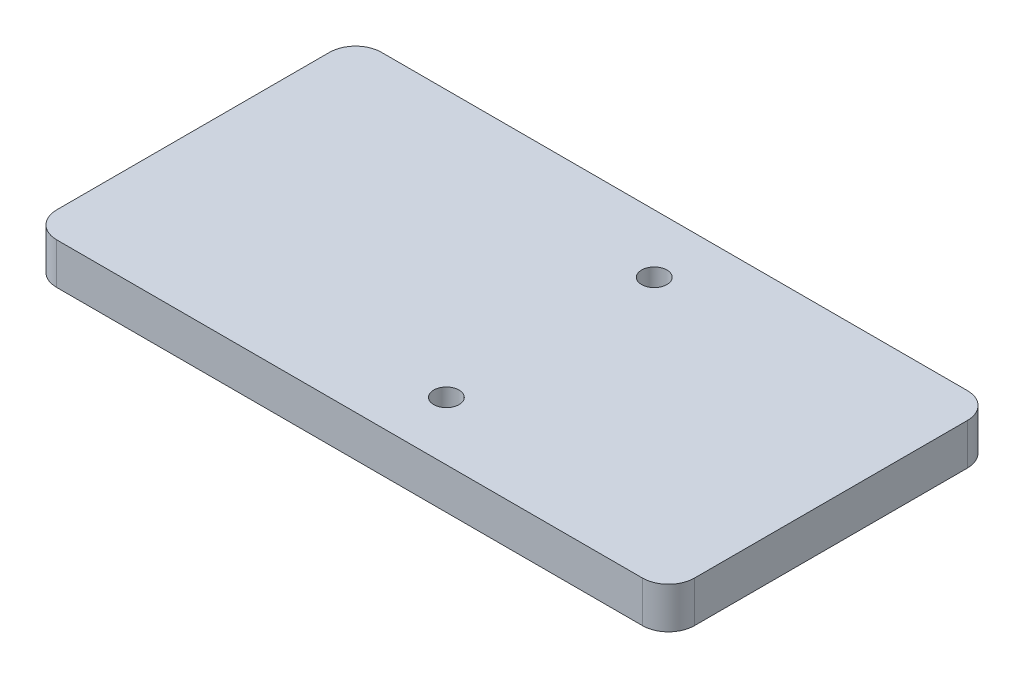
from build123d import *

# Parameters (mm, degrees)
SKETCH1_W           = 98.18
SKETCH1_H           = 50
SKETCH1_R           = 1.95
BOSS_EXTRUDE1_DEPTH = 6.35
FILLET1_R           = 4


with BuildPart() as part:
    # Sketch1 → Boss-Extrude1 (new body)
    with BuildSketch(Plane(origin=(0, 0, 0), x_dir=(1, 0, 0), z_dir=(0, 1, 0))):
        Rectangle(SKETCH1_W, SKETCH1_H)
        with Locations(Location((5.9, 16, 0), (0, 0, 270))):
            Circle(SKETCH1_R, mode=Mode.SUBTRACT)
        with Locations(Location((5.9, -16, 0), (0, 0, 270))):
            Circle(SKETCH1_R, mode=Mode.SUBTRACT)
    extrude(amount=BOSS_EXTRUDE1_DEPTH)

    # Fillet1
    fillet1_edges = [part.edges().sort_by_distance(p)[0] for p in [
        (49.09, 3.175, 25),
        (-49.09, 3.175, 25),
        (-49.09, 3.175, -25),
        (49.09, 3.175, -25),
    ]]
    fillet(fillet1_edges, radius=FILLET1_R)


solid = part.part
